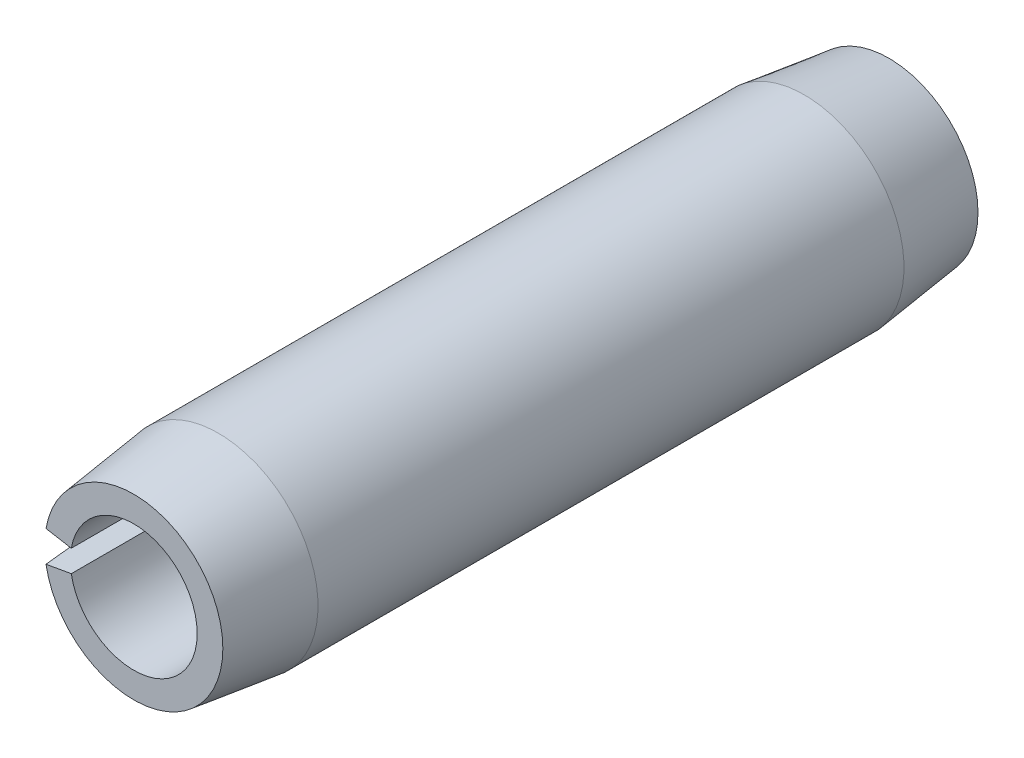
from build123d import *

# Parameters (mm, degrees)
EXTRUDE1_DEPTH = 3.175


with BuildPart() as part:
    # Sketch1 → Extrude1 (new, symmetric)
    with BuildSketch(Plane.XY):
        with BuildLine():
            Line((-0.825465859, 0.145551903), (-0.525296455, 0.092623938))
            ThreePointArc((-0.525296455, 0.092623938), (0.5334, 0), (-0.525296455, -0.092623938))
            Line((-0.525296455, -0.092623938), (-0.825465859, -0.145551903))
            ThreePointArc((-0.825465859, -0.145551903), (0.8382, 0), (-0.825465859, 0.145551903))
        make_face()
    extrude(amount=EXTRUDE1_DEPTH, both=True)

    # Sketch2 → Cut-Revolve1 (revolve, cut)
    with BuildSketch(Plane(origin=(0, 0, 0), x_dir=(0, 0, -1), z_dir=(1, 0, 0))):
        Polygon((3.175, 0.8382), (3.175, 0.7493), (2.4638, 0.8382), align=None)
        Polygon((-2.4638, 0.8382), (-3.175, 0.8382), (-3.175, 0.7493), align=None)
    revolve(axis=Axis((0, 0, -3.175), (0, 0, 1)), mode=Mode.SUBTRACT)


solid = part.part
